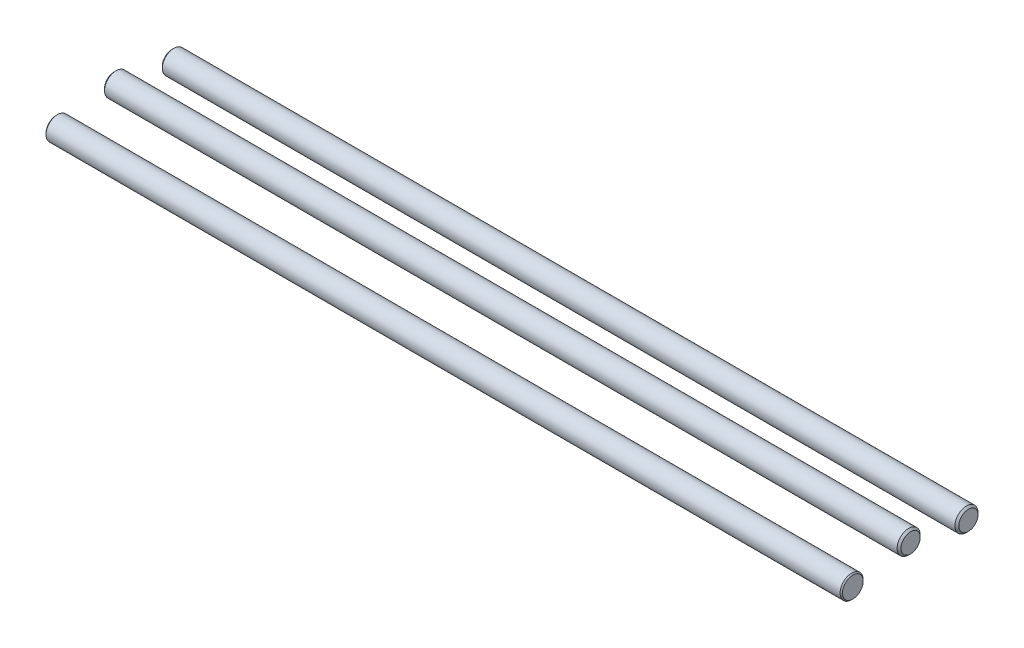
from build123d import *

# Parameters (mm, degrees)
BOSS_EXTRUDE1_START   = -36.7
SKETCH2_R             = 3
BOSS_EXTRUDE1_DEPTH   = 103.4
BOSS_EXTRUDE1_2_DEPTH = 103.4
BOSS_EXTRUDE1_3_DEPTH = 103.4
CHAMFER1_SIZE         = 0.3
CHAMFER2_SIZE         = 0.5
CHAMFER3_SIZE         = 0.5


with BuildPart() as part:
    # Sketch2 → Boss-Extrude1 (new body)
    with BuildSketch(Plane(origin=(0, 0, 0), x_dir=(0, 0, -1), z_dir=(1, 0, 0)).offset(BOSS_EXTRUDE1_START)):
        with Locations((15, -2.457885097)):
            Circle(SKETCH2_R)
    extrude(amount=-BOSS_EXTRUDE1_DEPTH)

    # Chamfer3
    chamfer3_edges = [part.edges().sort_by_distance(p)[0] for p in [
        (-36.7, -2.457885097, -12),
    ]]
    chamfer(chamfer3_edges, length=CHAMFER3_SIZE)

    # Mirror9 3: part across plane


with BuildPart() as body_2:
    # Sketch2 → Boss-Extrude1 2 (new body)
    with BuildSketch(Plane(origin=(0, 0, 0), x_dir=(0, 0, -1), z_dir=(1, 0, 0)).offset(BOSS_EXTRUDE1_START)):
        with Locations((-15, -2.457885097)):
            Circle(SKETCH2_R)
    extrude(amount=-BOSS_EXTRUDE1_2_DEPTH)

    # Chamfer1
    chamfer1_edges = [body_2.edges().sort_by_distance(p)[0] for p in [
        (-36.7, -2.457885097, 18),
    ]]
    chamfer(chamfer1_edges, length=CHAMFER1_SIZE)

    # Mirror9 2: body 2 across plane


with BuildPart() as body_3:
    # Sketch2 → Boss-Extrude1 3 (new body)
    with BuildSketch(Plane(origin=(0, 0, 0), x_dir=(0, 0, -1), z_dir=(1, 0, 0)).offset(BOSS_EXTRUDE1_START)):
        Circle(SKETCH2_R)
    extrude(amount=-BOSS_EXTRUDE1_3_DEPTH)

    # Chamfer2
    chamfer2_edges = [body_3.edges().sort_by_distance(p)[0] for p in [
        (-36.7, 0, 3),
    ]]
    chamfer(chamfer2_edges, length=CHAMFER2_SIZE)

    # Mirror9: body 3 across plane


with BuildPart() as body_3_1:
    add(body_3.part)
    add(body_3.part.mirror(Plane(origin=(-140.1, 0, 0), x_dir=(0, 0, 1), z_dir=(1, 0, 0))))


with BuildPart() as body_2_1:
    add(body_2.part)
    add(body_2.part.mirror(Plane(origin=(-140.1, 0, 0), x_dir=(0, 0, 1), z_dir=(1, 0, 0))))


with BuildPart() as part_1:
    add(part.part)
    add(part.part.mirror(Plane(origin=(-140.1, 0, 0), x_dir=(0, 0, 1), z_dir=(1, 0, 0))))


solid = Compound([body_3_1.part, body_2_1.part, part_1.part])
